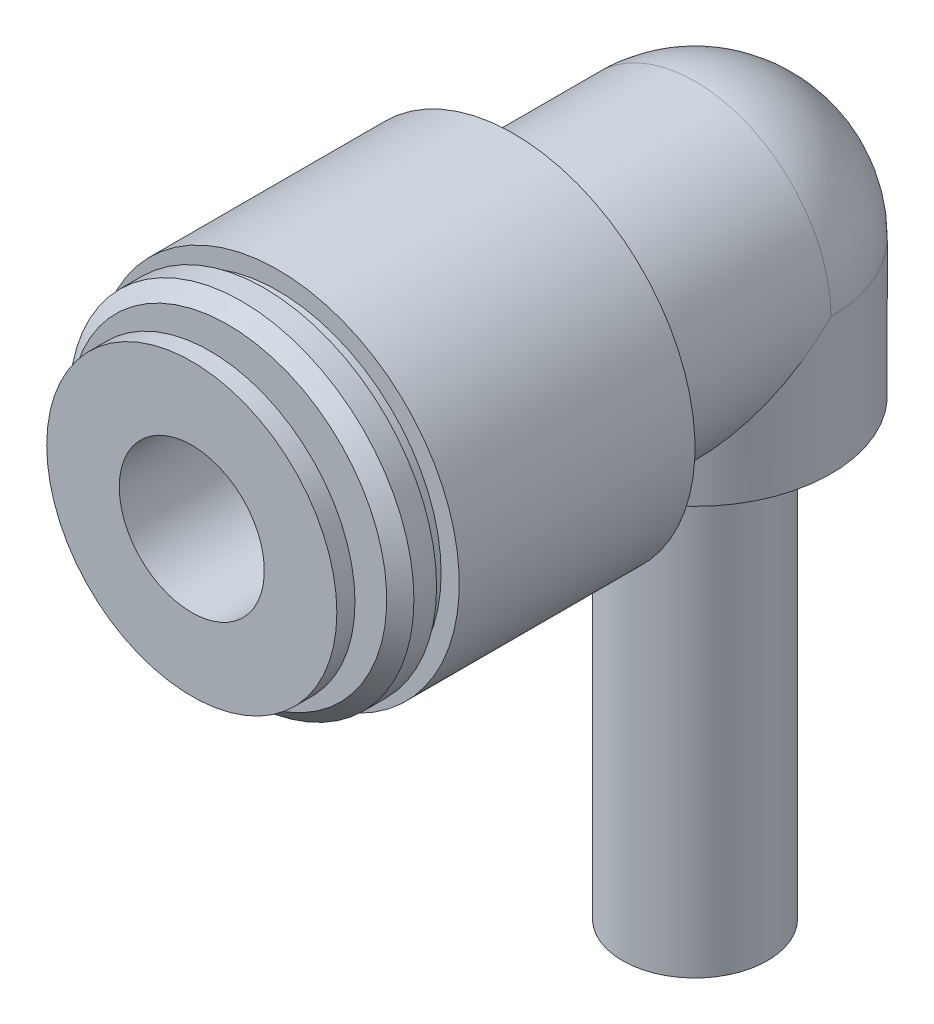
from build123d import *
from build123d.topology import SkipClean

# Parameters (mm, degrees)
SKETCH_1_R          = 4
SKETCH_1_R_2        = 3
EXTRUDE_1_DEPTH     = 25
SKETCH_3_R          = 7.5
EXTRUDE_2_DEPTH     = 10
SKETCH_4_R          = 10
EXTRUDE_3_DEPTH     = 13
SKETCH_6_R          = 4
CUT_EXTRUDE_1_DEPTH = 28


with BuildPart() as part:
    # Эскиз1 → Бобышка-Вытянуть1 (new body)
    with BuildSketch(Plane(origin=(0, 0, 0), x_dir=(1, 0, 0), z_dir=(0, 1, 0))):
        with Locations(Location((0, 0, 0), (0, 0, 270))):
            Circle(SKETCH_1_R)
        with Locations(Location((0, 0, 0), (0, 0, 270))):
            Circle(SKETCH_1_R_2, mode=Mode.SUBTRACT)
    extrude(amount=EXTRUDE_1_DEPTH)

    # Эскиз2 → Повернуть1 (revolve)
    with BuildSketch(Plane.XY, mode=Mode.PRIVATE) as revolve_1_sk:
        with BuildLine():
            Line((0, 25), (0, 40))
            ThreePointArc((0, 40), (5.303300859, 37.803300859), (7.5, 32.5))
            Line((7.5, 32.5), (7.5, 25))
            Line((7.5, 25), (0, 25))
        make_face()
    revolve(revolve_1_sk.sketch.rotate(Axis((0, 25, 0), (0, 1, 0)), 90), axis=Axis((0, 25, 0), (0, 1, 0)))

    # Эскиз3 → Бобышка-Вытянуть2 (add)
    with SkipClean():  # the faces are left unmerged after this step: merging them gives an invalid solid
        with BuildSketch(Plane.XY):
            with Locations((0, 32.5)):
                Circle(SKETCH_3_R)
        extrude(amount=EXTRUDE_2_DEPTH)

    # Эскиз4 → Бобышка-Вытянуть3 (add)
    with SkipClean():  # the faces are left unmerged after this step: merging them gives an invalid solid
        with BuildSketch(Plane.XY.offset(10)):
            with Locations(Location((0, 32.5, 0), (0, 0, 180))):
                Circle(SKETCH_4_R)
        extrude(amount=EXTRUDE_3_DEPTH)

    # Эскиз5 → Повернуть3 (revolve)
    with SkipClean():  # the faces are left unmerged after this step: merging them gives an invalid solid
        with BuildSketch(Plane(origin=(0, 0, 0), x_dir=(0, 0, -1), z_dir=(1, 0, 0)), mode=Mode.PRIVATE) as revolve_3_sk:
            Polygon((-26.75, 24.5), (-26.75, 26.5), (-25.75, 26.5), (-25.75, 23.75), (-25, 23), (-23.75, 23), (-23.75, 23.5), (-23, 23.5), (-23, 28.5), (-27.75, 28.5), (-27.75, 24.5), align=None)
        revolve(revolve_3_sk.sketch.rotate(Axis((0, 32.5, 23), (0, 0, 1)), 270), axis=Axis((0, 32.5, 23), (0, 0, 1)))

    # Эскиз6 → Вырез-Вытянуть1 (cut)
    with SkipClean():  # the faces are left unmerged after this step: merging them gives an invalid solid
        with BuildSketch(Plane.XY.offset(27.75)):
            with Locations(Location((0, 32.5, 0), (0, 0, 180))):
                Circle(SKETCH_6_R)
        extrude(amount=-CUT_EXTRUDE_1_DEPTH, mode=Mode.SUBTRACT)


solid = part.part
